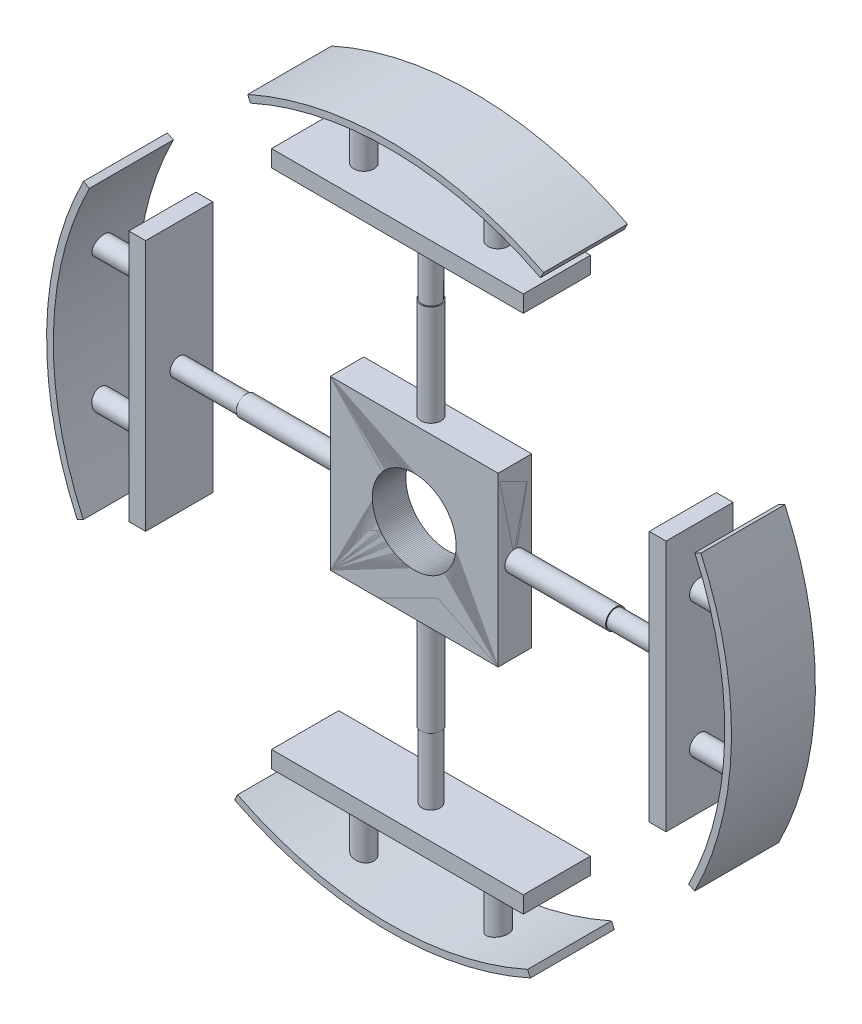
from build123d import *

# Parameters (mm, degrees)
SKETCH1_W                = 50
SKETCH1_H                = 50
BOSS_EXTRUDE1_DEPTH      = 5
SKETCH2_R                = 12.5
CUT_EXTRUDE1_DEPTH       = 5
SKETCH4_R                = 3
BOSS_EXTRUDE2_DEPTH      = 30
SKETCH5_R                = 2.7
CUT_EXTRUDE2_DEPTH       = 30
BOSS_EXTRUDE3_START      = 50
SKETCH6_R                = 2.7
BOSS_EXTRUDE3_DEPTH      = 50
SKETCH8_W                = 75
SKETCH8_H                = 5
BOSS_EXTRUDE4_DEPTH      = 10
BOSS_EXTRUDE5_DEPTH      = 12.5
BOSS_EXTRUDE6_REACH      = 117.324
BOSS_EXTRUDE6_END_RADIUS = 100
SKETCH9_R                = 3
BOSS_EXTRUDE7_REACH      = 117.324
BOSS_EXTRUDE7_END_RADIUS = 100
SKETCH9_3_R              = 3
CIRPATTERN5_COUNT        = 4


with BuildPart() as part:
    # Sketch1 → Boss-Extrude1 (new, symmetric)
    with BuildSketch(Plane.XY):
        Rectangle(SKETCH1_W, SKETCH1_H)
    extrude(amount=BOSS_EXTRUDE1_DEPTH, both=True)

    # Sketch2 → Cut-Extrude1 (cut, symmetric)
    with BuildSketch(Plane.XY):
        Circle(SKETCH2_R)
    extrude(amount=CUT_EXTRUDE1_DEPTH, both=True, mode=Mode.SUBTRACT)

    # Sketch4 → Boss-Extrude2 (add)
    with BuildSketch(Plane(origin=(0, 25, 0), x_dir=(1, 0, 0), z_dir=(0, 1, 0))):
        Circle(SKETCH4_R)
    extrude(amount=BOSS_EXTRUDE2_DEPTH)

    # Sketch5 → Cut-Extrude2 (cut)
    with BuildSketch(Plane(origin=(0, 55, 0), x_dir=(1, 0, 0), z_dir=(0, 1, 0))):
        Circle(SKETCH5_R)
    extrude(amount=-CUT_EXTRUDE2_DEPTH, mode=Mode.SUBTRACT)

    # Sketch6 → Boss-Extrude3 (add)
    with BuildSketch(Plane(origin=(0, 25, 0), x_dir=(1, 0, 0), z_dir=(0, 1, 0)).offset(BOSS_EXTRUDE3_START)):
        Circle(SKETCH6_R)
    extrude(amount=-BOSS_EXTRUDE3_DEPTH)

    # Sketch8 → Boss-Extrude4 (add, symmetric)
    with BuildSketch(Plane.XY):
        with Locations((0, 77.5)):
            Rectangle(SKETCH8_W, SKETCH8_H)
    extrude(amount=BOSS_EXTRUDE4_DEPTH, both=True)



with BuildPart() as body_2:
    # Sketch10 → Boss-Extrude5 (new, symmetric)
    with BuildSketch(Plane.XY):
        with BuildLine():
            Line((46.02576619, 91.02542967), (45.123300186, 89.240617324))
            ThreePointArc((45.123300186, 89.240617324), (2.132970087, 99.977249605), (-41.276156692, 91.083911251))
            Line((-41.276156692, 91.083911251), (-42.101679826, 92.905589476))
            ThreePointArc((-42.101679826, 92.905589476), (2.175629488, 101.976794597), (46.02576619, 91.02542967))
        make_face()
    extrude(amount=BOSS_EXTRUDE5_DEPTH, both=True)


with BuildPart() as part_1:
    add(part.part)

    add(body_2.part)  # Boss-Extrude6 merges body 2
    # Boss-Extrude6: up to this cylinder (the profile starts inside it)
    boss_extrude6_end = Plane(origin=(0, 0, 0), z_dir=(0, 0, -1)) * Cylinder(BOSS_EXTRUDE6_END_RADIUS, 435.648, mode=Mode.PRIVATE)
    # Sketch9 → Boss-Extrude6 (add, up to the surface)
    with BuildSketch(Plane(origin=(0, 80, 0), x_dir=(1, 0, 0), z_dir=(0, 1, 0)), mode=Mode.PRIVATE) as boss_extrude6_sk1:
        with Locations((-20, 0)):
            Circle(SKETCH9_R)
    boss_extrude6_tool1 = extrude(boss_extrude6_sk1.sketch, amount=BOSS_EXTRUDE6_REACH, mode=Mode.PRIVATE) & boss_extrude6_end
    add(boss_extrude6_tool1.solids().sort_by_distance((-20, 80, 0))[0])

    # Boss-Extrude7: up to this cylinder (the profile starts inside it)
    boss_extrude7_end = Plane(origin=(0, 0, 0), z_dir=(0, 0, -1)) * Cylinder(BOSS_EXTRUDE7_END_RADIUS, 435.648, mode=Mode.PRIVATE)
    # Sketch9<3> → Boss-Extrude7 (add, up to the surface)
    with BuildSketch(Plane(origin=(0, 80, 0), x_dir=(1, 0, 0), z_dir=(0, 1, 0)), mode=Mode.PRIVATE) as boss_extrude7_sk1:
        with Locations((20, 0)):
            Circle(SKETCH9_3_R)
    boss_extrude7_tool1 = extrude(boss_extrude7_sk1.sketch, amount=BOSS_EXTRUDE7_REACH, mode=Mode.PRIVATE) & boss_extrude7_end
    add(boss_extrude7_tool1.solids().sort_by_distance((20, 80, 0))[0])


with BuildPart() as cirpattern5_1:
    # CirPattern5: pattern copy
    add(part_1.part.rotate(Axis((0, 0, 0), (0, 0, -1)), 1 * 360 / CIRPATTERN5_COUNT))


with BuildPart() as cirpattern5_2:
    # CirPattern5: pattern copy
    add(part_1.part.rotate(Axis((0, 0, 0), (0, 0, -1)), 2 * 360 / CIRPATTERN5_COUNT))


with BuildPart() as cirpattern5_3:
    # CirPattern5: pattern copy
    add(part_1.part.rotate(Axis((0, 0, 0), (0, 0, -1)), 3 * 360 / CIRPATTERN5_COUNT))


solid = Compound([part_1.part, cirpattern5_1.part, cirpattern5_2.part, cirpattern5_3.part])
